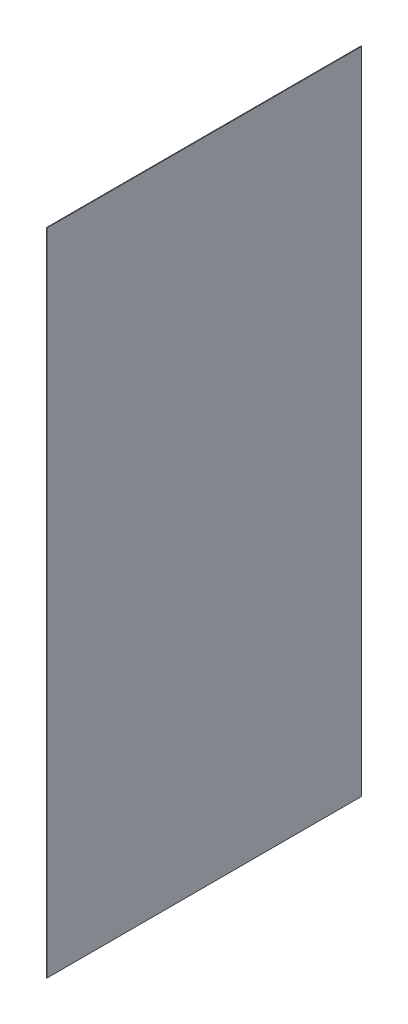
from build123d import *

# Parameters (mm, degrees)
SKETCH1_W           = 1720.85
SKETCH1_H           = 3556
BOSS_EXTRUDE1_DEPTH = 3.175


with BuildPart() as part:
    # Sketch1 → Boss-Extrude1 (new body)
    with BuildSketch(Plane(origin=(0, 0, 0), x_dir=(0, 0, -1), z_dir=(1, 0, 0))):
        with Locations((827.562862771, 1726.139439685)):
            Rectangle(SKETCH1_W, SKETCH1_H)
    extrude(amount=BOSS_EXTRUDE1_DEPTH)


solid = part.part
